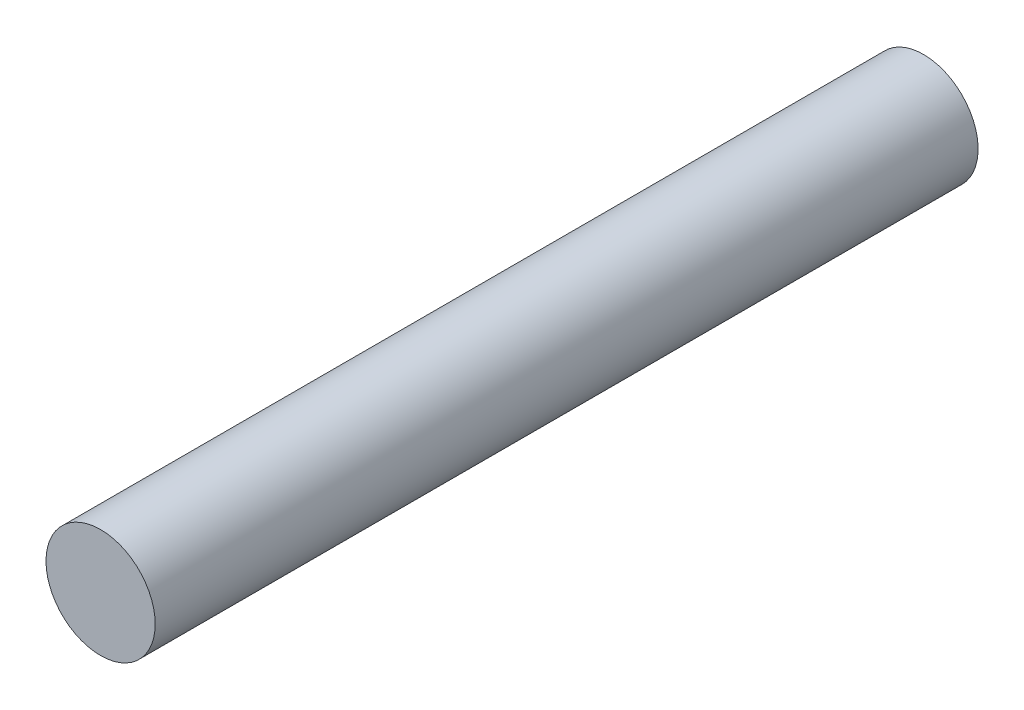
from build123d import *

# Parameters (mm, degrees)
SKETCH_1_R          = 20
EXTRUDE_1_DEPTH     = 266.5
EXTRUDE_START       = 35
SKETCH_3_R          = 20
EXTRUDE_2_DEPTH     = 35
CUT_EXTRUDE_1_DEPTH = 25
SKETCH_5_R          = 5
CUT_EXTRUDE_2_DEPTH = 10


with BuildPart() as part:
    # 스케치1 → 보스-돌출1 (new body)
    with BuildSketch(Plane.XY):
        Circle(SKETCH_1_R)
    extrude(amount=EXTRUDE_1_DEPTH)

    # 스케치3 → 보스-돌출2 (add)
    with BuildSketch(Plane(origin=(0, 0, 0), x_dir=(-1, 0, 0), z_dir=(0, 0, -1)).offset(EXTRUDE_START)):
        Circle(SKETCH_3_R)
    extrude(amount=-EXTRUDE_2_DEPTH)

    # 스케치4 → 컷-돌출1 (cut)
    with BuildSketch(Plane(origin=(0, 0, -35), x_dir=(-1, 0, 0), z_dir=(0, 0, -1))):
        with BuildLine():
            Line((-3.515670801, 3.555286039), (-3.484261495, -3.586073317))
            ThreePointArc((-3.484261495, -3.586073317), (4.99995164, 0.021990913), (-3.515670801, 3.555286039))
        make_face()
    extrude(amount=-CUT_EXTRUDE_1_DEPTH, mode=Mode.SUBTRACT)

    # 스케치5 → 컷-돌출2 (cut)
    with BuildSketch(Plane(origin=(0, 0, -35), x_dir=(-1, 0, 0), z_dir=(0, 0, -1))):
        Circle(SKETCH_5_R)
    extrude(amount=-CUT_EXTRUDE_2_DEPTH, mode=Mode.SUBTRACT)


solid = part.part
